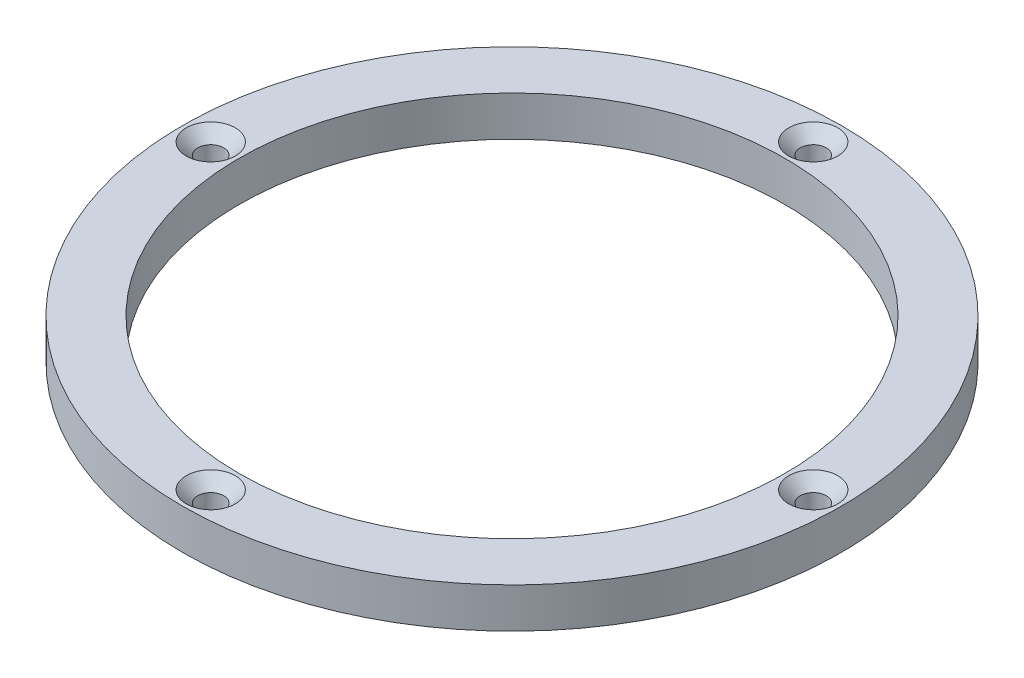
from build123d import *

# Parameters (mm, degrees)
SKETCH1_R                                       = 69.9
SKETCH1_R_2                                     = 57.9
BOSS_EXTRUDE1_DEPTH                             = 8.5
CSK_FOR_M5_FLAT_HEAD_MACHINE_SCREW1_D           = 5.5
CSK_FOR_M5_FLAT_HEAD_MACHINE_SCREW1_DEPTH       = 30
CSK_FOR_M5_FLAT_HEAD_MACHINE_SCREW1_CSINK_D     = 10.4
CSK_FOR_M5_FLAT_HEAD_MACHINE_SCREW1_CSINK_ANGLE = 90
CSK_FOR_M5_FLAT_HEAD_MACHINE_SCREW1_TIP         = 1.652366702


with BuildPart() as part:
    # Sketch1 → Boss-Extrude1 (new body)
    with BuildSketch(Plane(origin=(0, 0, 0), x_dir=(1, 0, 0), z_dir=(0, 1, 0))):
        with Locations(Location((0, 0, 0), (0, 0, 270))):
            Circle(SKETCH1_R)
        with Locations(Location((0, 0, 0), (0, 0, 270))):
            Circle(SKETCH1_R_2, mode=Mode.SUBTRACT)
    extrude(amount=BOSS_EXTRUDE1_DEPTH)

    # CSK for M5 Flat Head Machine Screw1
    with Locations(Plane(origin=(0, 8.5, 0), x_dir=(1, 0, 0), z_dir=(0, 1, 0))):
        with Locations((0, 63.9), (63.9, 0), (0, -63.9), (-63.9, 0)):
            CounterSinkHole(CSK_FOR_M5_FLAT_HEAD_MACHINE_SCREW1_D / 2, CSK_FOR_M5_FLAT_HEAD_MACHINE_SCREW1_CSINK_D / 2, depth=CSK_FOR_M5_FLAT_HEAD_MACHINE_SCREW1_DEPTH, counter_sink_angle=CSK_FOR_M5_FLAT_HEAD_MACHINE_SCREW1_CSINK_ANGLE)
            with Locations((0, 0, -(CSK_FOR_M5_FLAT_HEAD_MACHINE_SCREW1_DEPTH + CSK_FOR_M5_FLAT_HEAD_MACHINE_SCREW1_TIP / 2))):  # 118° drill point
                Cone(0, CSK_FOR_M5_FLAT_HEAD_MACHINE_SCREW1_D / 2, CSK_FOR_M5_FLAT_HEAD_MACHINE_SCREW1_TIP, mode=Mode.SUBTRACT)


solid = part.part
